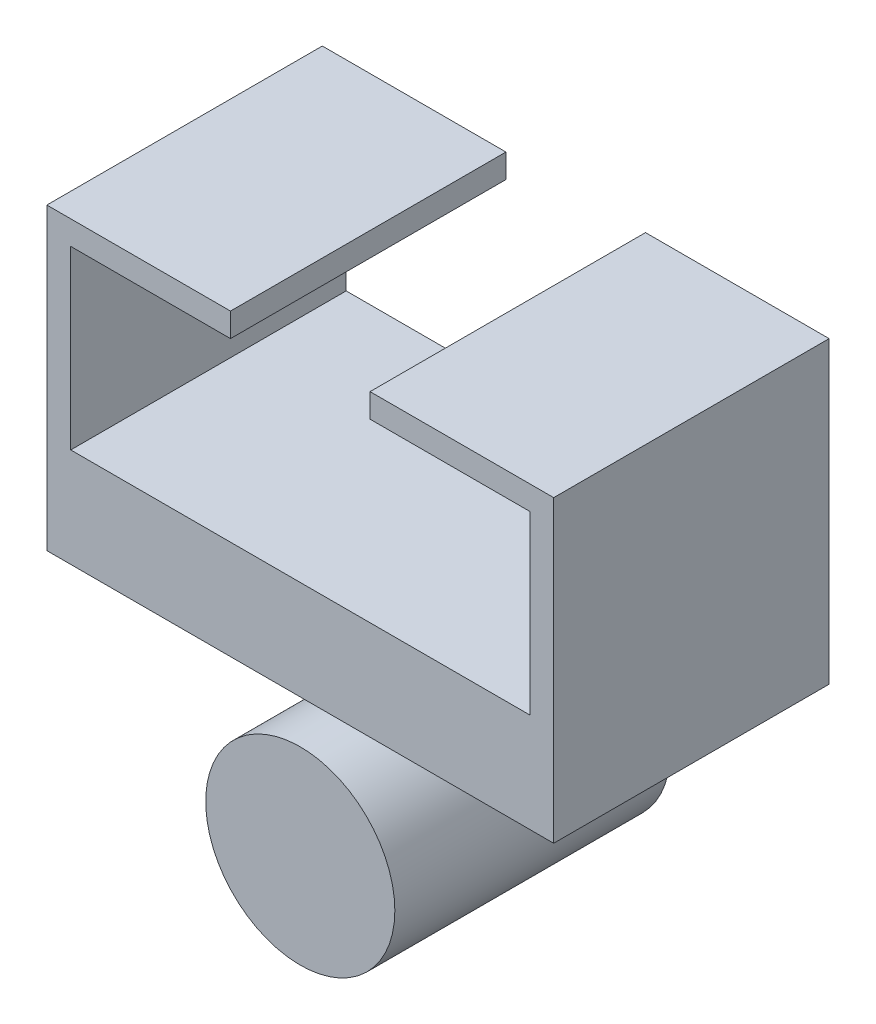
from build123d import *

# Parameters (mm, degrees)
SKETCH1_R           = 13.081
BOSS_EXTRUDE1_DEPTH = 38.1
SKETCH2_W           = 26.162
SKETCH2_H           = 19.05
BOSS_EXTRUDE2_DEPTH = 3.556
SKETCH4_W           = 63.5
SKETCH4_H           = 38.1
BOSS_EXTRUDE3_DEPTH = 13.716
SKETCH6_W           = 38.1
SKETCH6_H           = 38.1
BOSS_EXTRUDE4_DEPTH = 3.302
SKETCH7_W           = 25.4
SKETCH7_H           = 38.1
BOSS_EXTRUDE5_DEPTH = 3.302


with BuildPart() as part:
    # Sketch1 → Boss-Extrude1 (new body)
    with BuildSketch(Plane.XY):
        Circle(SKETCH1_R)
    extrude(amount=BOSS_EXTRUDE1_DEPTH)

    # Sketch2 → Boss-Extrude2 (add)
    with BuildSketch(Plane(origin=(0, 0, 0), x_dir=(-1, 0, 0), z_dir=(0, 0, -1))):
        with Locations((0, 9.525)):
            Rectangle(SKETCH2_W, SKETCH2_H)
    extrude(amount=-BOSS_EXTRUDE2_DEPTH)

    # Sketch4 → Boss-Extrude3 (add)
    with BuildSketch(Plane(origin=(0, 19.05, 0), x_dir=(1, 0, 0), z_dir=(0, 1, 0))):
        with Locations((0, -19.05)):
            Rectangle(SKETCH4_W, SKETCH4_H)
    extrude(amount=BOSS_EXTRUDE3_DEPTH)

    # Sketch6 → Boss-Extrude4 (add)
    with BuildSketch(Plane(origin=(31.75, 0, 0), x_dir=(0, 0, -1), z_dir=(1, 0, 0))):
        with Locations((-19.05, 38.1)):
            Rectangle(SKETCH6_W, SKETCH6_H)
    boss_extrude4 = extrude(amount=BOSS_EXTRUDE4_DEPTH)

    # Mirror1: Boss-Extrude4 across plane
    add(boss_extrude4.mirror(Plane(origin=(0, 0, 0), x_dir=(0, 0, 1), z_dir=(1, 0, 0))))

    # Sketch7 → Boss-Extrude5 (add)
    with BuildSketch(Plane(origin=(0, 57.15, 0), x_dir=(1, 0, 0), z_dir=(0, 1, 0))):
        with Locations((22.352, -19.05)):
            Rectangle(SKETCH7_W, SKETCH7_H)
    boss_extrude5 = extrude(amount=BOSS_EXTRUDE5_DEPTH)

    # Mirror2: Boss-Extrude5 across plane
    add(boss_extrude5.mirror(Plane(origin=(0, 0, 0), x_dir=(0, 0, 1), z_dir=(1, 0, 0))))


solid = part.part
